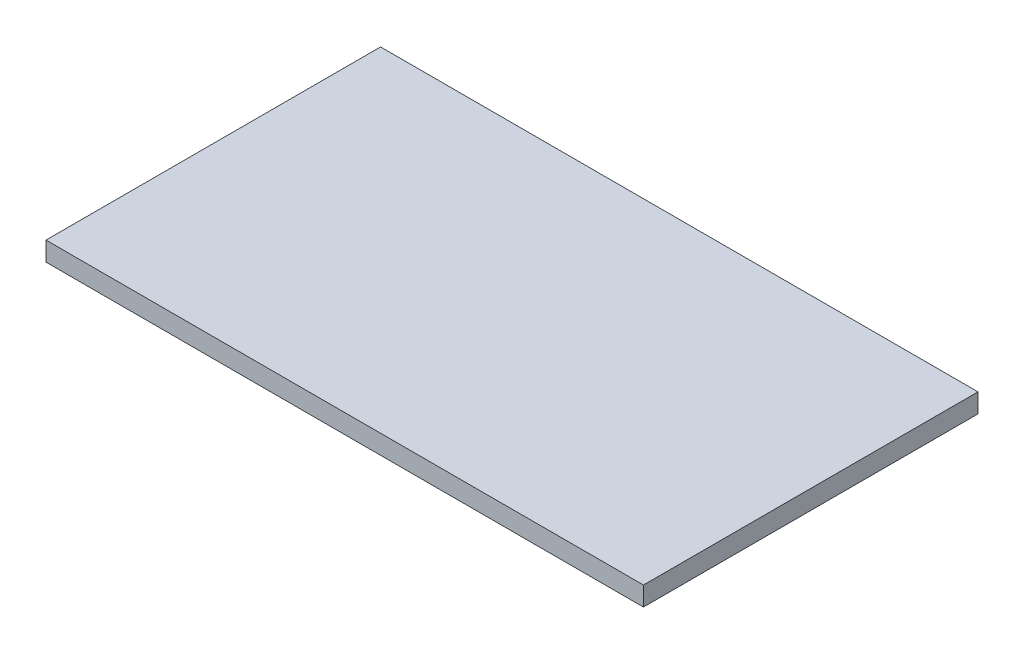
from build123d import *

# Parameters (mm, degrees)
SKETCH1_W      = 50
SKETCH1_H      = 28
EXTRUDE1_DEPTH = 1.6


with BuildPart() as part:
    # Sketch1 → Extrude1 (new body)
    with BuildSketch(Plane(origin=(0, 0, 0), x_dir=(1, 0, 0), z_dir=(0, 1, 0))):
        Rectangle(SKETCH1_W, SKETCH1_H)
    extrude(amount=EXTRUDE1_DEPTH)


solid = part.part
